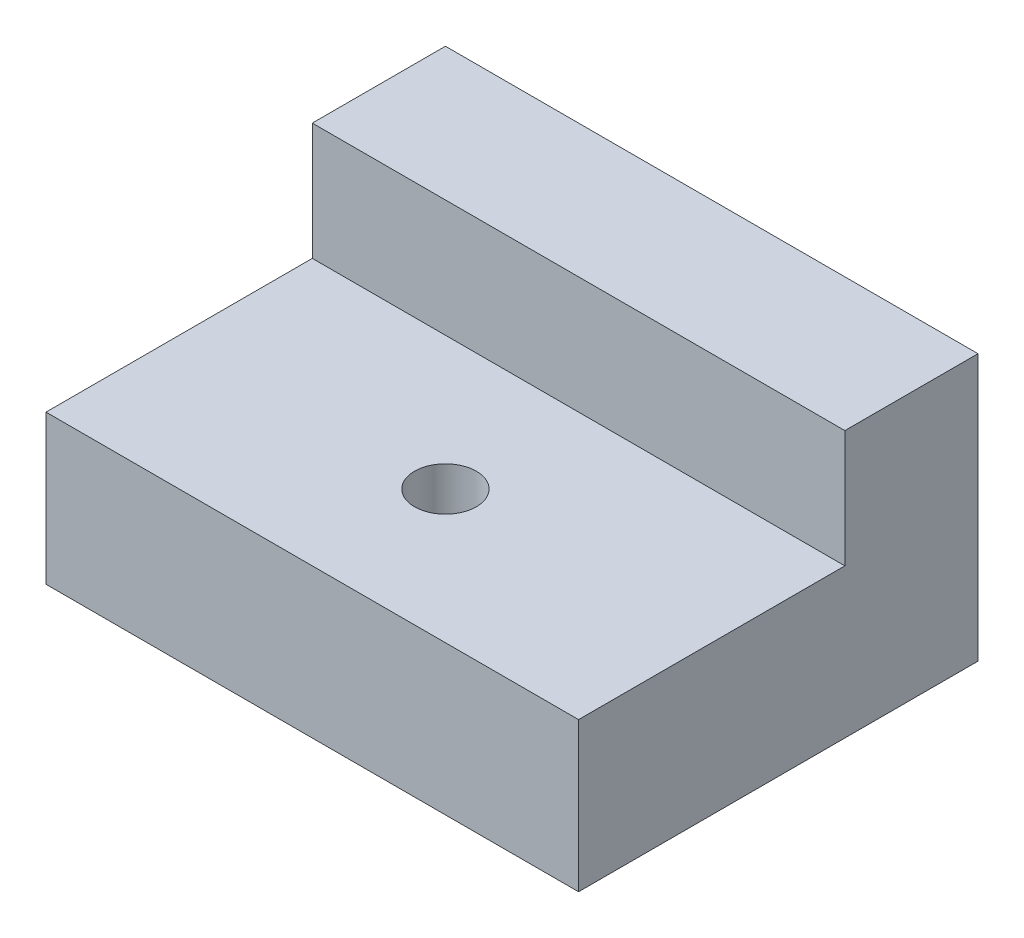
from build123d import *

# Parameters (mm, degrees)
SKETCH1_W                   = 25.4
SKETCH1_H                   = 19.05
BOSS_EXTRUDE1_DEPTH         = 7.112
SKETCH2_W                   = 25.4
SKETCH2_H                   = 6.35
BOSS_EXTRUDE2_DEPTH         = 5.588
F_32_0_116_DIAMETER_HOLE1_D = 2.9464


with BuildPart() as part:
    # Sketch1 → Boss-Extrude1 (new body)
    with BuildSketch(Plane(origin=(0, 0, 0), x_dir=(1, 0, 0), z_dir=(0, 1, 0))):
        with Locations((12.7, 9.525)):
            Rectangle(SKETCH1_W, SKETCH1_H)
    extrude(amount=BOSS_EXTRUDE1_DEPTH)

    # Sketch2 → Boss-Extrude2 (add)
    with BuildSketch(Plane(origin=(0, 7.112, 0), x_dir=(1, 0, 0), z_dir=(0, 1, 0))):
        with Locations((12.7, 15.875)):
            Rectangle(SKETCH2_W, SKETCH2_H)
    extrude(amount=BOSS_EXTRUDE2_DEPTH)

    # #32 (0.116) Diameter Hole1 (through all)
    with Locations(Plane(origin=(0, 7.112, 0), x_dir=(1, 0, 0), z_dir=(0, 1, 0))):
        with Locations((12.7, 6.35)):
            Hole(F_32_0_116_DIAMETER_HOLE1_D / 2)


solid = part.part
